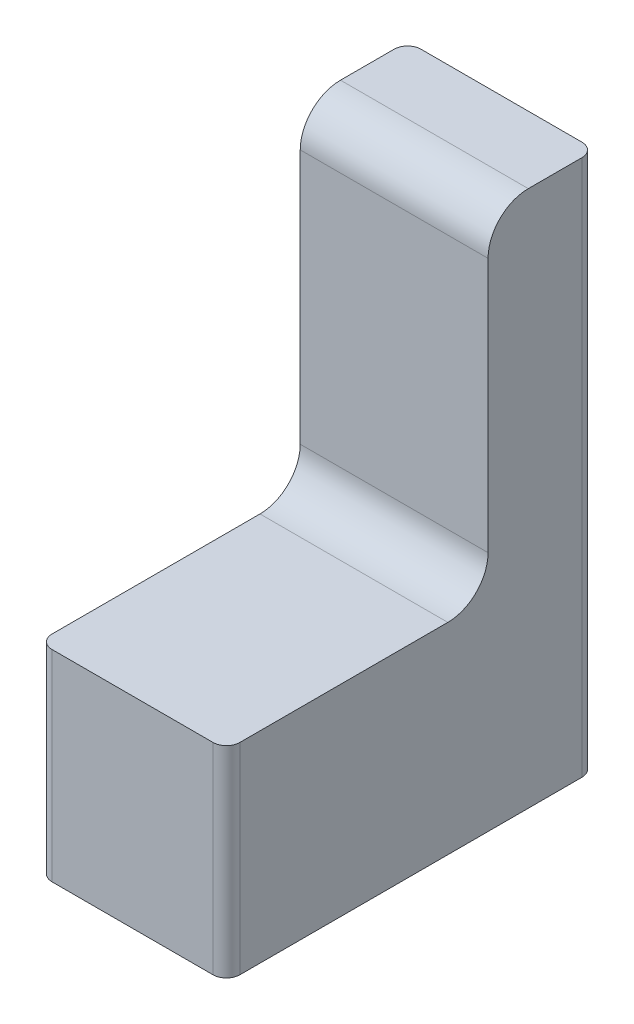
from build123d import *

# Parameters (mm, degrees)
SKETCH1_W                   = 14
SKETCH1_H                   = 27.5
BOSS_EXTRUDE1_DEPTH         = 40
CUT_EXTRUDE1_REACH          = 46.554
SKETCH2_W                   = 19.5
SKETCH2_H                   = 25
FILLET1_R                   = 3
M6_TAPPED_HOLE1_D           = 5
M6_TAPPED_HOLE1_DEPTH       = 12
M6_TAPPED_HOLE1_CSINK_D     = 6.05
M6_TAPPED_HOLE1_CSINK_ANGLE = 90
M6_TAPPED_HOLE1_TIP         = 1.502151548
FILLET2_R                   = 1


with BuildPart() as part:
    # Sketch1 → Boss-Extrude1 (new body)
    with BuildSketch(Plane(origin=(0, 0, 0), x_dir=(1, 0, 0), z_dir=(0, 1, 0))):
        Rectangle(SKETCH1_W, SKETCH1_H)
    extrude(amount=-BOSS_EXTRUDE1_DEPTH)

    # Sketch2 → Cut-Extrude1 (cut, up to next)
    with BuildSketch(Plane(origin=(7, 0, 0), x_dir=(0, 0, -1), z_dir=(1, 0, 0)), mode=Mode.PRIVATE) as cut_extrude1_sk1:
        with Locations((-4, -12.5)):
            Rectangle(SKETCH2_W, SKETCH2_H)
    cut_extrude1_tool1 = extrude(cut_extrude1_sk1.sketch, amount=-CUT_EXTRUDE1_REACH, mode=Mode.PRIVATE) & part.part
    add(cut_extrude1_tool1.solids().sort_by_distance((7, -12.5, 4))[0], mode=Mode.SUBTRACT)

    # Fillet1
    fillet1_edges = [part.edges().sort_by_distance(p)[0] for p in [
        (0, 0, -5.75),
        (0, -25, -5.75),
    ]]
    fillet(fillet1_edges, radius=FILLET1_R)

    # M6 Tapped Hole1
    with Locations(Plane(origin=(0, -40, 0), x_dir=(-1, 0, 0), z_dir=(0, -1, 0))):
        with Locations((0, -7.75), (0, 7.75)):
            CounterSinkHole(M6_TAPPED_HOLE1_D / 2, M6_TAPPED_HOLE1_CSINK_D / 2, depth=M6_TAPPED_HOLE1_DEPTH, counter_sink_angle=M6_TAPPED_HOLE1_CSINK_ANGLE)
            with Locations((0, 0, -(M6_TAPPED_HOLE1_DEPTH + M6_TAPPED_HOLE1_TIP / 2))):  # 118° drill point
                Cone(0, M6_TAPPED_HOLE1_D / 2, M6_TAPPED_HOLE1_TIP, mode=Mode.SUBTRACT)

    # Fillet2
    fillet2_edges = [part.edges().sort_by_distance(p)[0] for p in [
        (7, -32.5, 13.75),
        (-7, -32.5, 13.75),
        (-7, -20, -13.75),
        (7, -20, -13.75),
    ]]
    fillet(fillet2_edges, radius=FILLET2_R)


solid = part.part
